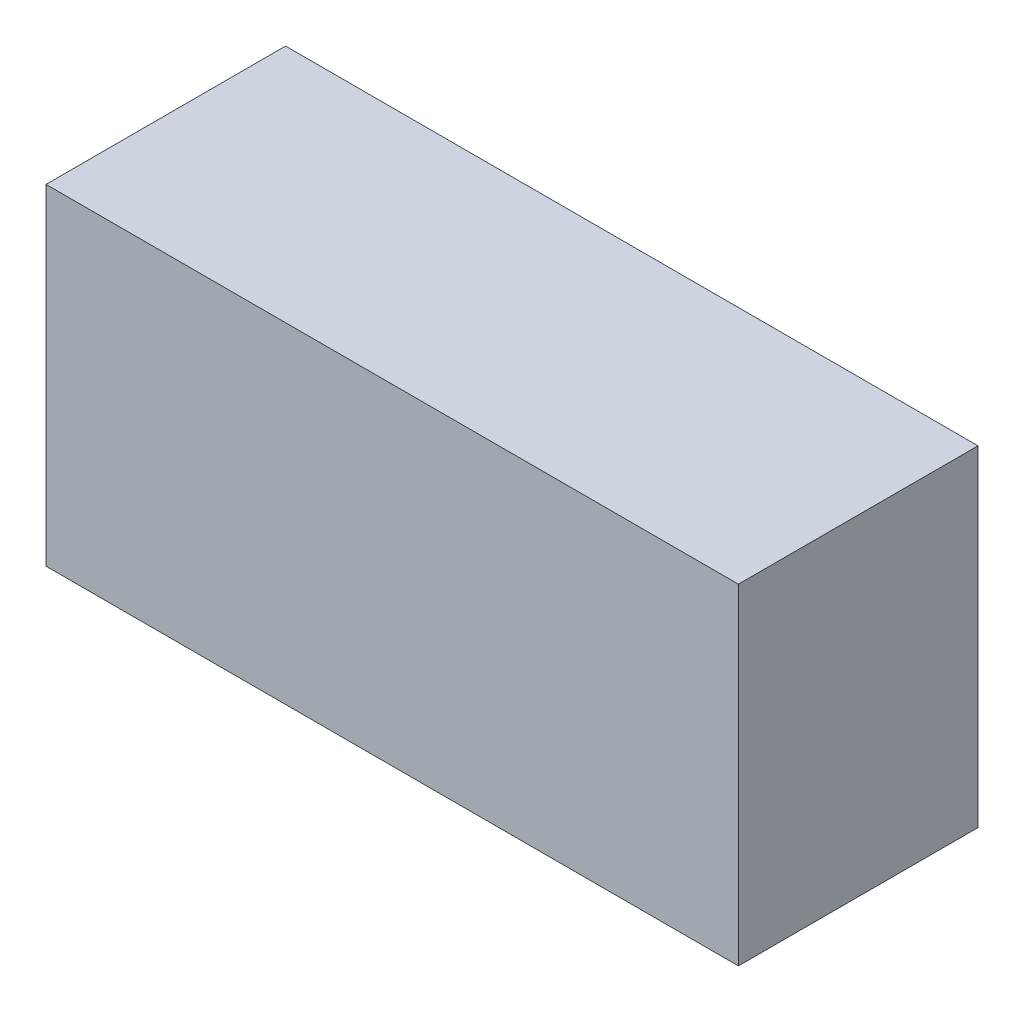
from build123d import *

# Parameters (mm, degrees)
SKETCH1_W           = 28.90002
SKETCH1_H           = 13.80001
BOSS_EXTRUDE1_DEPTH = 10


with BuildPart() as part:
    # Sketch1 → Boss-Extrude1 (new body)
    with BuildSketch(Plane.XY):
        with Locations((0, -2.5e-05)):
            Rectangle(SKETCH1_W, SKETCH1_H)
    extrude(amount=BOSS_EXTRUDE1_DEPTH)


solid = part.part
